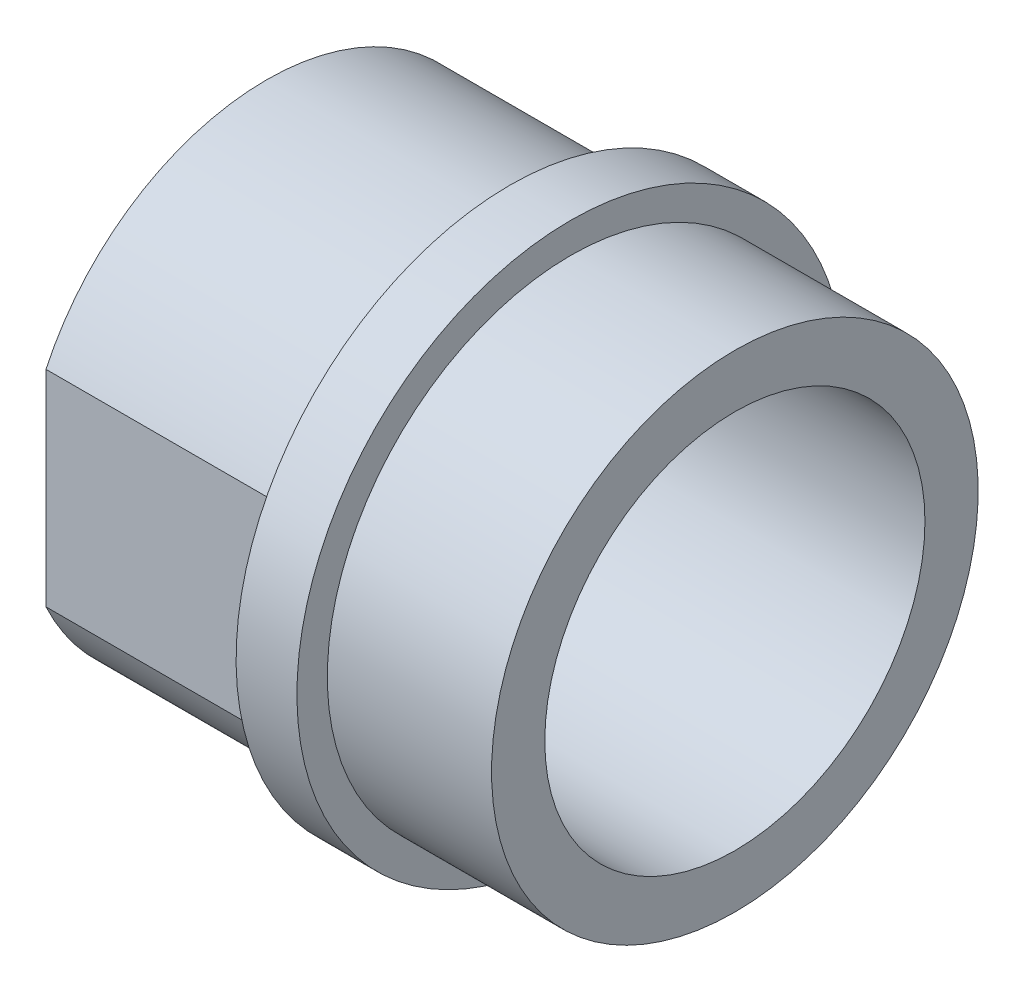
from build123d import *

# Parameters (mm, degrees)
SKETCH_4_R          = 6.25
CUT_EXTRUDE_1_DEPTH = 10
SKETCH_5_W          = 4.872533435
SKETCH_5_H          = 19.874807433
CUT_EXTRUDE_2_DEPTH = 8


with BuildPart() as part:
    # 草图3 → 旋转1 (revolve)
    with BuildSketch(Plane.XY):
        Polygon((0, 0), (0, 8), (8, 8), (8, 9), (10, 9), (10, 8), (15.4, 8), (15.4, 0), align=None)
    revolve(axis=Axis((15.4, 0, 0), (-1, 0, 0)))

    # 草图4 → 切除-拉伸1 (cut)
    with BuildSketch(Plane.ZY.offset(-15.4)):
        with Locations(Location((0, 0, 0), (0, 0, 270))):
            Circle(SKETCH_4_R)
    extrude(amount=CUT_EXTRUDE_1_DEPTH, mode=Mode.SUBTRACT)

    # 草图5 → 切除-拉伸2 (cut)
    with BuildSketch(Plane.ZY):
        with Locations((9.686266718, -0.512898256)):
            Rectangle(SKETCH_5_W, SKETCH_5_H)
        with Locations((-9.686266718, -0.512898256)):
            Rectangle(SKETCH_5_W, SKETCH_5_H)
    extrude(amount=-CUT_EXTRUDE_2_DEPTH, mode=Mode.SUBTRACT)


solid = part.part
